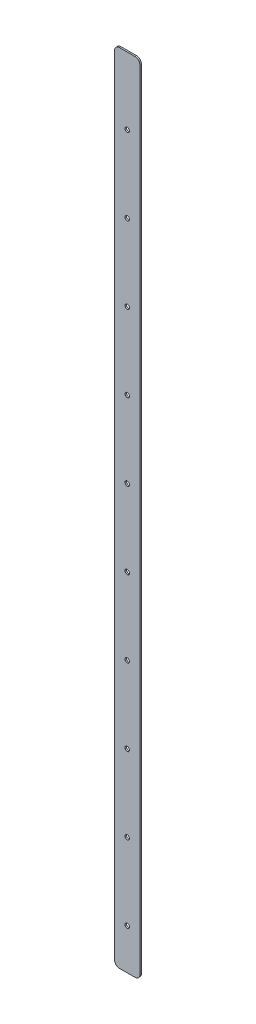
from build123d import *

# Parameters (mm, degrees)
SKETCH_1_W             = 50
SKETCH_1_H             = 1562
EXTRUDE_1_DEPTH        = 3
FILLET_1_R             = 10
SKETCH_2_R             = 4.4
CUT_EXTRUDE_1_DEPTH    = 10
PATTERN_LINEAR_1_COUNT = 10
PATTERN_LINEAR_1_PITCH = 150


with BuildPart() as part:
    # Эскиз1 → Бобышка-Вытянуть1 (new body)
    with BuildSketch(Plane.XY):
        Rectangle(SKETCH_1_W, SKETCH_1_H)
    extrude(amount=EXTRUDE_1_DEPTH)

    # Скругление1
    fillet_1_edges = [part.edges().sort_by_distance(p)[0] for p in [
        (25, -781, 1.5),
        (-25, -781, 1.5),
        (-25, 781, 1.5),
        (25, 781, 1.5),
    ]]
    fillet(fillet_1_edges, radius=FILLET_1_R)

    # Эскиз2 → Вырез-Вытянуть1 (cut)
    with BuildSketch(Plane.XY.offset(3)):
        with Locations((0, -701)):
            Circle(SKETCH_2_R)
    cut_extrude_1 = extrude(amount=-CUT_EXTRUDE_1_DEPTH, mode=Mode.SUBTRACT)

    # Линейный массив1: Вырез-Вытянуть1 ×10
    with Locations(*[(0, i * PATTERN_LINEAR_1_PITCH, 0) for i in range(1, PATTERN_LINEAR_1_COUNT)]):
        add(cut_extrude_1, mode=Mode.SUBTRACT)


solid = part.part
